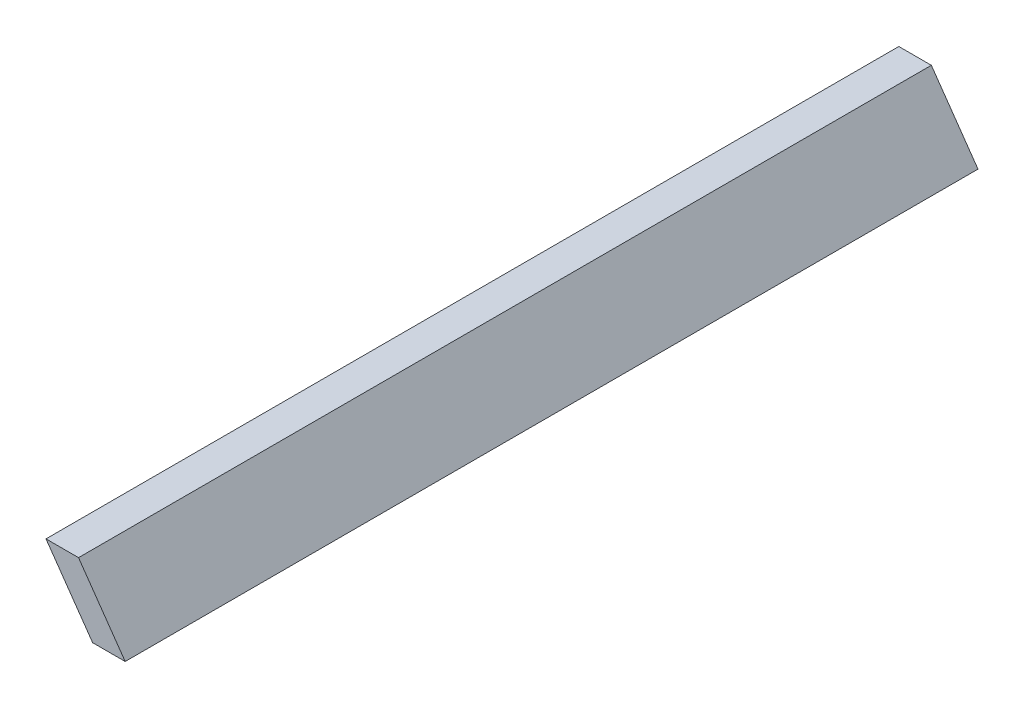
from build123d import *

# Parameters (mm, degrees)
BOSS_EXTRUDE1_DEPTH = 203.2
CUT_EXTRUDE1_DEPTH  = 7.112


with BuildPart() as part:
    # end-profile → Boss-Extrude1 (new body)
    with BuildSketch(Plane.XY):
        Polygon((0, 0), (-7.751918639, 0), (-18.867713308, 15.875), (-11.115794669, 15.875), align=None)
    extrude(amount=BOSS_EXTRUDE1_DEPTH)

    # Sketch4 → Cut-Extrude1 (cut)
    with BuildSketch(Plane(origin=(-18.867713308, 0, 0), x_dir=(0, 0, -1), z_dir=(1, 0, 0))):
        with BuildLine():
            Line((-180.141175267, 7.9375), (-180.141175267, 0))
            Line((-180.141175267, 0), (-173.366995267, 0))
            Line((-173.366995267, 0), (-173.366995267, 7.9375))
            ThreePointArc((-173.366995267, 7.9375), (-176.754085267, 11.32459), (-180.141175267, 7.9375))
        make_face()
        with BuildLine():
            Line((-142.041175267, 7.9375), (-142.041175267, 0))
            Line((-142.041175267, 0), (-135.266995267, 0))
            Line((-135.266995267, 0), (-135.266995267, 7.9375))
            ThreePointArc((-135.266995267, 7.9375), (-138.654085267, 11.32459), (-142.041175267, 7.9375))
        make_face()
        with BuildLine():
            Line((-103.941175267, 7.9375), (-103.941175267, 0))
            Line((-103.941175267, 0), (-97.166995267, 0))
            Line((-97.166995267, 0), (-97.166995267, 7.9375))
            ThreePointArc((-97.166995267, 7.9375), (-100.554085267, 11.32459), (-103.941175267, 7.9375))
        make_face()
        with BuildLine():
            Line((-65.841175267, 7.9375), (-65.841175267, 0))
            Line((-65.841175267, 0), (-59.066995267, 0))
            Line((-59.066995267, 0), (-59.066995267, 7.9375))
            ThreePointArc((-59.066995267, 7.9375), (-62.454085267, 11.32459), (-65.841175267, 7.9375))
        make_face()
        with BuildLine():
            Line((-27.741175267, 7.9375), (-27.741175267, 0))
            Line((-27.741175267, 0), (-20.966995267, 0))
            Line((-20.966995267, 0), (-20.966995267, 7.9375))
            ThreePointArc((-20.966995267, 7.9375), (-24.354085267, 11.32459), (-27.741175267, 7.9375))
        make_face()
    extrude(amount=CUT_EXTRUDE1_DEPTH, mode=Mode.SUBTRACT)


solid = part.part
